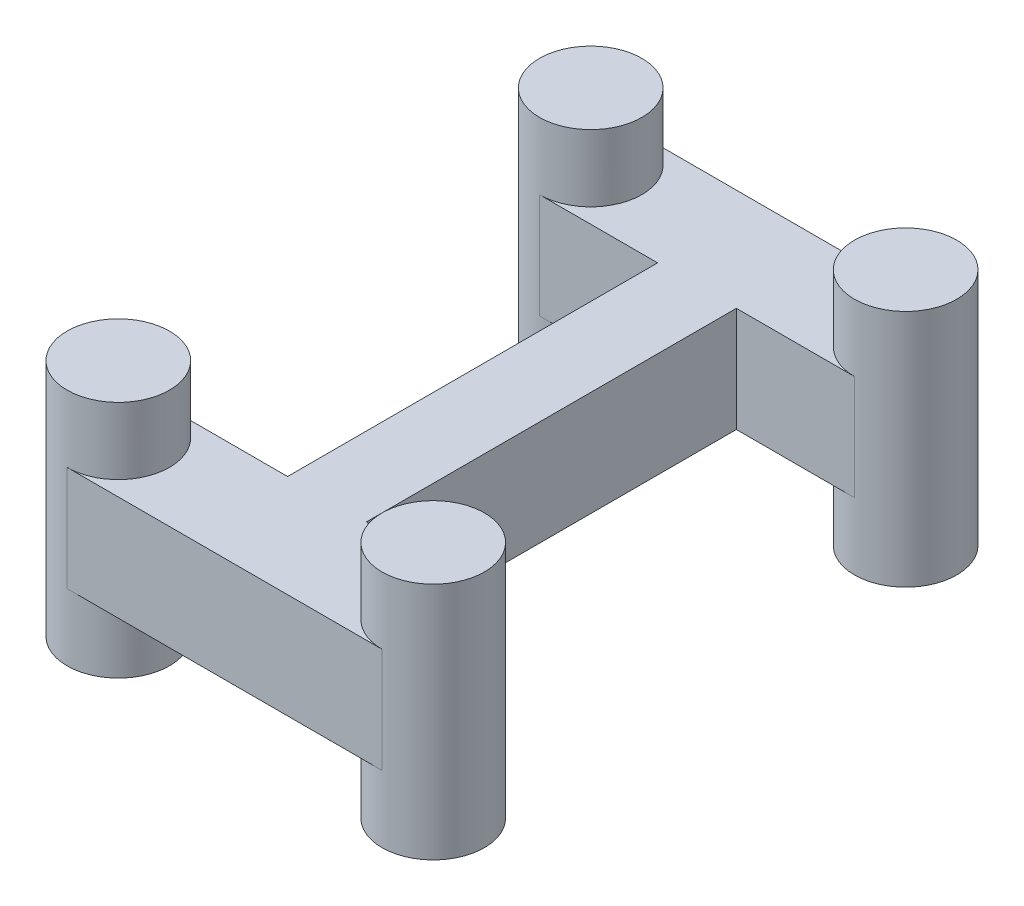
from build123d import *

# Parameters (mm, degrees)
BOSS_EXTRUDE1_DEPTH      = 2
BOSS_EXTRUDE1_DEPTH_BACK = 2
BOSS_EXTRUDE2_DEPTH      = 4.55
BOSS_EXTRUDE2_DEPTH_BACK = 4.55
SKETCH1_4_R              = 1.95


with BuildPart() as part:
    # Sketch1 → Boss-Extrude1 (new, two sides: drawn at the far end of the back side and taken through both)
    with BuildSketch(Plane(origin=(0, 0, 0), x_dir=(1, 0, 0), z_dir=(0, 1, 0)).offset(-BOSS_EXTRUDE1_DEPTH_BACK)):
        with BuildLine():
            ThreePointArc((-4.05, -9), (-4.621141777, -10.378858223), (-6, -10.95))
            Line((-6, -10.95), (6, -10.95))
            ThreePointArc((6, -10.95), (4.05, -9), (6, -7.05))
            Line((6, -7.05), (1.5, -7.05))
            Line((1.5, -7.05), (1.5, 7.05))
            Line((1.5, 7.05), (6, 7.05))
            ThreePointArc((6, 7.05), (4.05, 9), (6, 10.95))
            Line((6, 10.95), (-6, 10.95))
            ThreePointArc((-6, 10.95), (-4.621141777, 10.378858223), (-4.05, 9))
            ThreePointArc((-4.05, 9), (-4.621141777, 7.621141777), (-6, 7.05))
            Line((-6, 7.05), (-1.5, 7.05))
            Line((-1.5, 7.05), (-1.5, -7.05))
            Line((-1.5, -7.05), (-6, -7.05))
            ThreePointArc((-6, -7.05), (-4.621141777, -7.621141777), (-4.05, -9))
        make_face()
    extrude(amount=BOSS_EXTRUDE1_DEPTH + BOSS_EXTRUDE1_DEPTH_BACK)

    # Sketch1<4> → Boss-Extrude2 (add, two sides: drawn at the far end of the back side and taken through both)
    with BuildSketch(Plane(origin=(0, 0, 0), x_dir=(1, 0, 0), z_dir=(0, 1, 0)).offset(-BOSS_EXTRUDE2_DEPTH_BACK)):
        with Locations((-6, -9)):
            Circle(SKETCH1_4_R)
        with Locations((6, -9)):
            Circle(SKETCH1_4_R)
        with Locations((-6, 9)):
            Circle(SKETCH1_4_R)
        with Locations((6, 9)):
            Circle(SKETCH1_4_R)
    extrude(amount=BOSS_EXTRUDE2_DEPTH + BOSS_EXTRUDE2_DEPTH_BACK)


solid = part.part
